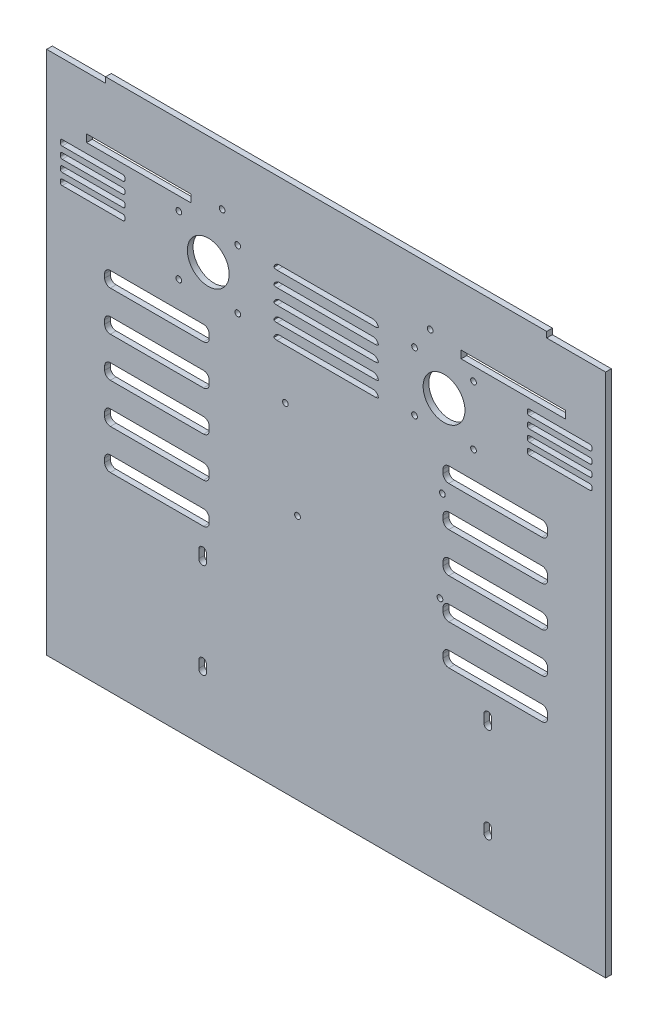
from build123d import *

# Parameters (mm, degrees)
SKETCH1_W           = 55
SKETCH1_H           = 4
SKETCH1_R           = 1.5
SKETCH1_R_2         = 11
BOSS_EXTRUDE1_DEPTH = 3


with BuildPart() as part:
    # Sketch1 → Boss-Extrude1 (new body)
    with BuildSketch(Plane.XY):
        Polygon((-147, -123.5), (147, -123.5), (147, 152.5), (116, 152.5), (116, 155.5), (-116, 155.5), (-116, 152.5), (-147, 152.5), align=None)
        with Locations((-98.5, 122.5)):
            Rectangle(SKETCH1_W, SKETCH1_H, mode=Mode.SUBTRACT)
        with Locations((98.5, 122.5)):
            Rectangle(SKETCH1_W, SKETCH1_H, mode=Mode.SUBTRACT)
        with BuildLine():
            ThreePointArc((-63, -89.5), (-65, -91.5), (-67, -89.5))
            Line((-67, -89.5), (-67, -85.57834269))
            ThreePointArc((-67, -85.57834269), (-65, -83.57834269), (-63, -85.57834269))
            Line((-63, -85.57834269), (-63, -89.5))
        make_face(mode=Mode.SUBTRACT)
        with BuildLine():
            ThreePointArc((-64.5, -15.5), (-62.378679656, -16.378679656), (-61.5, -18.5))
            Line((-61.5, -18.5), (-61.5, -20.5))
            ThreePointArc((-61.5, -20.5), (-62.378679656, -22.621320344), (-64.5, -23.5))
            Line((-64.5, -23.5), (-113.5, -23.5))
            ThreePointArc((-113.5, -23.5), (-115.621320344, -22.621320344), (-116.5, -20.5))
            Line((-116.5, -20.5), (-116.5, -18.5))
            ThreePointArc((-116.5, -18.5), (-115.621320344, -16.378679656), (-113.5, -15.5))
            Line((-113.5, -15.5), (-64.5, -15.5))
        make_face(mode=Mode.SUBTRACT)
        with BuildLine():
            ThreePointArc((-64.5, 5.5), (-62.378679656, 4.621320344), (-61.5, 2.5))
            Line((-61.5, 2.5), (-61.5, 0.5))
            ThreePointArc((-61.5, 0.5), (-62.378679656, -1.621320344), (-64.5, -2.5))
            Line((-64.5, -2.5), (-113.5, -2.5))
            ThreePointArc((-113.5, -2.5), (-115.621320344, -1.621320344), (-116.5, 0.5))
            Line((-116.5, 0.5), (-116.5, 2.5))
            ThreePointArc((-116.5, 2.5), (-115.621320344, 4.621320344), (-113.5, 5.5))
            Line((-113.5, 5.5), (-64.5, 5.5))
        make_face(mode=Mode.SUBTRACT)
        with BuildLine():
            ThreePointArc((-63, -39.5), (-65, -41.5), (-67, -39.5))
            Line((-67, -39.5), (-67, -35.07834269))
            ThreePointArc((-67, -35.07834269), (-65, -33.07834269), (-63, -35.07834269))
            Line((-63, -35.07834269), (-63, -39.5))
        make_face(mode=Mode.SUBTRACT)
        with Locations((-15.078681203, 5.935129713)):
            Circle(SKETCH1_R, mode=Mode.SUBTRACT)
        with BuildLine():
            ThreePointArc((87, -89.5), (85, -91.5), (83, -89.5))
            Line((83, -89.5), (83, -85.57834269))
            ThreePointArc((83, -85.57834269), (85, -83.57834269), (87, -85.57834269))
            Line((87, -85.57834269), (87, -89.5))
        make_face(mode=Mode.SUBTRACT)
        with Locations((59.851318797, 5.935129713)):
            Circle(SKETCH1_R, mode=Mode.SUBTRACT)
        with BuildLine():
            ThreePointArc((87, -39.5), (85, -41.5), (83, -39.5))
            Line((83, -39.5), (83, -35.07834269))
            ThreePointArc((83, -35.07834269), (85, -33.07834269), (87, -35.07834269))
            Line((87, -35.07834269), (87, -39.5))
        make_face(mode=Mode.SUBTRACT)
        with BuildLine():
            Line((64.5, -15.5), (113.5, -15.5))
            ThreePointArc((113.5, -15.5), (115.621320344, -16.378679656), (116.5, -18.5))
            Line((116.5, -18.5), (116.5, -20.5))
            ThreePointArc((116.5, -20.5), (115.621320344, -22.621320344), (113.5, -23.5))
            Line((113.5, -23.5), (64.5, -23.5))
            ThreePointArc((64.5, -23.5), (62.378679656, -22.621320344), (61.5, -20.5))
            Line((61.5, -20.5), (61.5, -18.5))
            ThreePointArc((61.5, -18.5), (62.378679656, -16.378679656), (64.5, -15.5))
        make_face(mode=Mode.SUBTRACT)
        with BuildLine():
            Line((64.5, 5.5), (113.5, 5.5))
            ThreePointArc((113.5, 5.5), (115.621320344, 4.621320344), (116.5, 2.5))
            Line((116.5, 2.5), (116.5, 0.5))
            ThreePointArc((116.5, 0.5), (115.621320344, -1.621320344), (113.5, -2.5))
            Line((113.5, -2.5), (64.5, -2.5))
            ThreePointArc((64.5, -2.5), (62.378679656, -1.621320344), (61.5, 0.5))
            Line((61.5, 0.5), (61.5, 2.5))
            ThreePointArc((61.5, 2.5), (62.378679656, 4.621320344), (64.5, 5.5))
        make_face(mode=Mode.SUBTRACT)
        with BuildLine():
            ThreePointArc((-64.5, 26.5), (-62.378679656, 25.621320344), (-61.5, 23.5))
            Line((-61.5, 23.5), (-61.5, 21.5))
            ThreePointArc((-61.5, 21.5), (-62.378679656, 19.378679656), (-64.5, 18.5))
            Line((-64.5, 18.5), (-113.5, 18.5))
            ThreePointArc((-113.5, 18.5), (-115.621320344, 19.378679656), (-116.5, 21.5))
            Line((-116.5, 21.5), (-116.5, 23.5))
            ThreePointArc((-116.5, 23.5), (-115.621320344, 25.621320344), (-113.5, 26.5))
            Line((-113.5, 26.5), (-64.5, 26.5))
        make_face(mode=Mode.SUBTRACT)
        with BuildLine():
            ThreePointArc((-64.5, 47.5), (-62.378679656, 46.621320344), (-61.5, 44.5))
            Line((-61.5, 44.5), (-61.5, 42.5))
            ThreePointArc((-61.5, 42.5), (-62.378679656, 40.378679656), (-64.5, 39.5))
            Line((-64.5, 39.5), (-113.5, 39.5))
            ThreePointArc((-113.5, 39.5), (-115.621320344, 40.378679656), (-116.5, 42.5))
            Line((-116.5, 42.5), (-116.5, 44.5))
            ThreePointArc((-116.5, 44.5), (-115.621320344, 46.621320344), (-113.5, 47.5))
            Line((-113.5, 47.5), (-64.5, 47.5))
        make_face(mode=Mode.SUBTRACT)
        with BuildLine():
            ThreePointArc((-64.5, 68.5), (-62.378679656, 67.621320344), (-61.5, 65.5))
            Line((-61.5, 65.5), (-61.5, 63.5))
            ThreePointArc((-61.5, 63.5), (-62.378679656, 61.378679656), (-64.5, 60.5))
            Line((-64.5, 60.5), (-113.5, 60.5))
            ThreePointArc((-113.5, 60.5), (-115.621320344, 61.378679656), (-116.5, 63.5))
            Line((-116.5, 63.5), (-116.5, 65.5))
            ThreePointArc((-116.5, 65.5), (-115.621320344, 67.621320344), (-113.5, 68.5))
            Line((-113.5, 68.5), (-64.5, 68.5))
        make_face(mode=Mode.SUBTRACT)
        with Locations((-77.5, 82.5)):
            Circle(SKETCH1_R, mode=Mode.SUBTRACT)
        with Locations((-46.5, 82.5)):
            Circle(SKETCH1_R, mode=Mode.SUBTRACT)
        with Locations((-21.428681203, 54.195129713)):
            Circle(SKETCH1_R, mode=Mode.SUBTRACT)
        with BuildLine():
            ThreePointArc((-106.82550191, 97.5), (-106.118395129, 97.207106781), (-105.82550191, 96.5))
            Line((-105.82550191, 96.5), (-105.82550191, 95.5))
            ThreePointArc((-105.82550191, 95.5), (-106.118395129, 94.792893219), (-106.82550191, 94.5))
            Line((-106.82550191, 94.5), (-138.82550191, 94.5))
            ThreePointArc((-138.82550191, 94.5), (-139.532608691, 94.792893219), (-139.82550191, 95.5))
            Line((-139.82550191, 95.5), (-139.82550191, 96.5))
            ThreePointArc((-139.82550191, 96.5), (-139.532608691, 97.207106781), (-138.82550191, 97.5))
            Line((-138.82550191, 97.5), (-106.82550191, 97.5))
        make_face(mode=Mode.SUBTRACT)
        with BuildLine():
            ThreePointArc((-106.82550191, 103.5), (-106.118395129, 103.207106781), (-105.82550191, 102.5))
            Line((-105.82550191, 102.5), (-105.82550191, 101.5))
            ThreePointArc((-105.82550191, 101.5), (-106.118395129, 100.792893219), (-106.82550191, 100.5))
            Line((-106.82550191, 100.5), (-138.82550191, 100.5))
            ThreePointArc((-138.82550191, 100.5), (-139.532608691, 100.792893219), (-139.82550191, 101.5))
            Line((-139.82550191, 101.5), (-139.82550191, 102.5))
            ThreePointArc((-139.82550191, 102.5), (-139.532608691, 103.207106781), (-138.82550191, 103.5))
            Line((-138.82550191, 103.5), (-106.82550191, 103.5))
        make_face(mode=Mode.SUBTRACT)
        with BuildLine():
            ThreePointArc((-106.82550191, 109.5), (-106.118395129, 109.207106781), (-105.82550191, 108.5))
            Line((-105.82550191, 108.5), (-105.82550191, 107.5))
            ThreePointArc((-105.82550191, 107.5), (-106.118395129, 106.792893219), (-106.82550191, 106.5))
            Line((-106.82550191, 106.5), (-138.82550191, 106.5))
            ThreePointArc((-138.82550191, 106.5), (-139.532608691, 106.792893219), (-139.82550191, 107.5))
            Line((-139.82550191, 107.5), (-139.82550191, 108.5))
            ThreePointArc((-139.82550191, 108.5), (-139.532608691, 109.207106781), (-138.82550191, 109.5))
            Line((-138.82550191, 109.5), (-106.82550191, 109.5))
        make_face(mode=Mode.SUBTRACT)
        with BuildLine():
            ThreePointArc((-106.82550191, 115.5), (-106.118395129, 115.207106781), (-105.82550191, 114.5))
            Line((-105.82550191, 114.5), (-105.82550191, 113.5))
            ThreePointArc((-105.82550191, 113.5), (-106.118395129, 112.792893219), (-106.82550191, 112.5))
            Line((-106.82550191, 112.5), (-138.82550191, 112.5))
            ThreePointArc((-138.82550191, 112.5), (-139.532608691, 112.792893219), (-139.82550191, 113.5))
            Line((-139.82550191, 113.5), (-139.82550191, 114.5))
            ThreePointArc((-139.82550191, 114.5), (-139.532608691, 115.207106781), (-138.82550191, 115.5))
            Line((-138.82550191, 115.5), (-106.82550191, 115.5))
        make_face(mode=Mode.SUBTRACT)
        with Locations((-77.5, 113.5)):
            Circle(SKETCH1_R, mode=Mode.SUBTRACT)
        with Locations((-62, 98)):
            Circle(SKETCH1_R_2, mode=Mode.SUBTRACT)
        with Locations((-46.5, 113.5)):
            Circle(SKETCH1_R, mode=Mode.SUBTRACT)
        with BuildLine():
            ThreePointArc((-27.5, 113), (-26.478451782, 114.791287847), (-24.541960108, 115.5))
            Line((-24.541960108, 115.5), (24.541960108, 115.5))
            ThreePointArc((24.541960108, 115.5), (26.478451782, 114.791287847), (27.5, 113))
            ThreePointArc((27.5, 113), (26.707713009, 112.627718677), (25.841687605, 112.5))
            Line((25.841687605, 112.5), (-25.841687605, 112.5))
            ThreePointArc((-25.841687605, 112.5), (-26.707713009, 112.627718677), (-27.5, 113))
        make_face(mode=Mode.SUBTRACT)
        with BuildLine():
            ThreePointArc((-27.5, 81), (-26.478451782, 82.791287847), (-24.541960108, 83.5))
            Line((-24.541960108, 83.5), (24.541960108, 83.5))
            ThreePointArc((24.541960108, 83.5), (26.478451782, 82.791287847), (27.5, 81))
            ThreePointArc((27.5, 81), (26.707713009, 80.627718677), (25.841687605, 80.5))
            Line((25.841687605, 80.5), (-25.841687605, 80.5))
            ThreePointArc((-25.841687605, 80.5), (-26.707713009, 80.627718677), (-27.5, 81))
        make_face(mode=Mode.SUBTRACT)
        with Locations((61.121318797, 54.195129713)):
            Circle(SKETCH1_R, mode=Mode.SUBTRACT)
        with Locations((46.5, 82.5)):
            Circle(SKETCH1_R, mode=Mode.SUBTRACT)
        with BuildLine():
            Line((64.5, 26.5), (113.5, 26.5))
            ThreePointArc((113.5, 26.5), (115.621320344, 25.621320344), (116.5, 23.5))
            Line((116.5, 23.5), (116.5, 21.5))
            ThreePointArc((116.5, 21.5), (115.621320344, 19.378679656), (113.5, 18.5))
            Line((113.5, 18.5), (64.5, 18.5))
            ThreePointArc((64.5, 18.5), (62.378679656, 19.378679656), (61.5, 21.5))
            Line((61.5, 21.5), (61.5, 23.5))
            ThreePointArc((61.5, 23.5), (62.378679656, 25.621320344), (64.5, 26.5))
        make_face(mode=Mode.SUBTRACT)
        with BuildLine():
            Line((64.5, 47.5), (113.5, 47.5))
            ThreePointArc((113.5, 47.5), (115.621320344, 46.621320344), (116.5, 44.5))
            Line((116.5, 44.5), (116.5, 42.5))
            ThreePointArc((116.5, 42.5), (115.621320344, 40.378679656), (113.5, 39.5))
            Line((113.5, 39.5), (64.5, 39.5))
            ThreePointArc((64.5, 39.5), (62.378679656, 40.378679656), (61.5, 42.5))
            Line((61.5, 42.5), (61.5, 44.5))
            ThreePointArc((61.5, 44.5), (62.378679656, 46.621320344), (64.5, 47.5))
        make_face(mode=Mode.SUBTRACT)
        with BuildLine():
            Line((64.5, 68.5), (113.5, 68.5))
            ThreePointArc((113.5, 68.5), (115.621320344, 67.621320344), (116.5, 65.5))
            Line((116.5, 65.5), (116.5, 63.5))
            ThreePointArc((116.5, 63.5), (115.621320344, 61.378679656), (113.5, 60.5))
            Line((113.5, 60.5), (64.5, 60.5))
            ThreePointArc((64.5, 60.5), (62.378679656, 61.378679656), (61.5, 63.5))
            Line((61.5, 63.5), (61.5, 65.5))
            ThreePointArc((61.5, 65.5), (62.378679656, 67.621320344), (64.5, 68.5))
        make_face(mode=Mode.SUBTRACT)
        with Locations((77.5, 82.5)):
            Circle(SKETCH1_R, mode=Mode.SUBTRACT)
        with BuildLine():
            ThreePointArc((-27.5, 89), (-26.478451782, 90.791287847), (-24.541960108, 91.5))
            Line((-24.541960108, 91.5), (24.541960108, 91.5))
            ThreePointArc((24.541960108, 91.5), (26.478451782, 90.791287847), (27.5, 89))
            ThreePointArc((27.5, 89), (26.707713009, 88.627718677), (25.841687605, 88.5))
            Line((25.841687605, 88.5), (-25.841687605, 88.5))
            ThreePointArc((-25.841687605, 88.5), (-26.707713009, 88.627718677), (-27.5, 89))
        make_face(mode=Mode.SUBTRACT)
        with BuildLine():
            ThreePointArc((-27.5, 97), (-26.478451782, 98.791287847), (-24.541960108, 99.5))
            Line((-24.541960108, 99.5), (24.541960108, 99.5))
            ThreePointArc((24.541960108, 99.5), (26.478451782, 98.791287847), (27.5, 97))
            ThreePointArc((27.5, 97), (26.707713009, 96.627718677), (25.841687605, 96.5))
            Line((25.841687605, 96.5), (-25.841687605, 96.5))
            ThreePointArc((-25.841687605, 96.5), (-26.707713009, 96.627718677), (-27.5, 97))
        make_face(mode=Mode.SUBTRACT)
        with BuildLine():
            ThreePointArc((-27.5, 105), (-26.478451782, 106.791287847), (-24.541960108, 107.5))
            Line((-24.541960108, 107.5), (24.541960108, 107.5))
            ThreePointArc((24.541960108, 107.5), (26.478451782, 106.791287847), (27.5, 105))
            ThreePointArc((27.5, 105), (26.707713009, 104.627718677), (25.841687605, 104.5))
            Line((25.841687605, 104.5), (-25.841687605, 104.5))
            ThreePointArc((-25.841687605, 104.5), (-26.707713009, 104.627718677), (-27.5, 105))
        make_face(mode=Mode.SUBTRACT)
        with Locations((62, 98)):
            Circle(SKETCH1_R_2, mode=Mode.SUBTRACT)
        with Locations((46.5, 113.5)):
            Circle(SKETCH1_R, mode=Mode.SUBTRACT)
        with Locations((77.5, 113.5)):
            Circle(SKETCH1_R, mode=Mode.SUBTRACT)
        with BuildLine():
            Line((106.82550191, 97.5), (138.82550191, 97.5))
            ThreePointArc((138.82550191, 97.5), (139.532608691, 97.207106781), (139.82550191, 96.5))
            Line((139.82550191, 96.5), (139.82550191, 95.5))
            ThreePointArc((139.82550191, 95.5), (139.532608691, 94.792893219), (138.82550191, 94.5))
            Line((138.82550191, 94.5), (106.82550191, 94.5))
            ThreePointArc((106.82550191, 94.5), (106.118395129, 94.792893219), (105.82550191, 95.5))
            Line((105.82550191, 95.5), (105.82550191, 96.5))
            ThreePointArc((105.82550191, 96.5), (106.118395129, 97.207106781), (106.82550191, 97.5))
        make_face(mode=Mode.SUBTRACT)
        with BuildLine():
            Line((106.82550191, 103.5), (138.82550191, 103.5))
            ThreePointArc((138.82550191, 103.5), (139.532608691, 103.207106781), (139.82550191, 102.5))
            Line((139.82550191, 102.5), (139.82550191, 101.5))
            ThreePointArc((139.82550191, 101.5), (139.532608691, 100.792893219), (138.82550191, 100.5))
            Line((138.82550191, 100.5), (106.82550191, 100.5))
            ThreePointArc((106.82550191, 100.5), (106.118395129, 100.792893219), (105.82550191, 101.5))
            Line((105.82550191, 101.5), (105.82550191, 102.5))
            ThreePointArc((105.82550191, 102.5), (106.118395129, 103.207106781), (106.82550191, 103.5))
        make_face(mode=Mode.SUBTRACT)
        with BuildLine():
            Line((106.82550191, 109.5), (138.82550191, 109.5))
            ThreePointArc((138.82550191, 109.5), (139.532608691, 109.207106781), (139.82550191, 108.5))
            Line((139.82550191, 108.5), (139.82550191, 107.5))
            ThreePointArc((139.82550191, 107.5), (139.532608691, 106.792893219), (138.82550191, 106.5))
            Line((138.82550191, 106.5), (106.82550191, 106.5))
            ThreePointArc((106.82550191, 106.5), (106.118395129, 106.792893219), (105.82550191, 107.5))
            Line((105.82550191, 107.5), (105.82550191, 108.5))
            ThreePointArc((105.82550191, 108.5), (106.118395129, 109.207106781), (106.82550191, 109.5))
        make_face(mode=Mode.SUBTRACT)
        with BuildLine():
            Line((106.82550191, 115.5), (138.82550191, 115.5))
            ThreePointArc((138.82550191, 115.5), (139.532608691, 115.207106781), (139.82550191, 114.5))
            Line((139.82550191, 114.5), (139.82550191, 113.5))
            ThreePointArc((139.82550191, 113.5), (139.532608691, 112.792893219), (138.82550191, 112.5))
            Line((138.82550191, 112.5), (106.82550191, 112.5))
            ThreePointArc((106.82550191, 112.5), (106.118395129, 112.792893219), (105.82550191, 113.5))
            Line((105.82550191, 113.5), (105.82550191, 114.5))
            ThreePointArc((105.82550191, 114.5), (106.118395129, 115.207106781), (106.82550191, 115.5))
        make_face(mode=Mode.SUBTRACT)
        with Locations((-54.7, 125.75)):
            Circle(SKETCH1_R, mode=Mode.SUBTRACT)
        with Locations((54.7, 125.75)):
            Circle(SKETCH1_R, mode=Mode.SUBTRACT)
    extrude(amount=BOSS_EXTRUDE1_DEPTH)


solid = part.part
